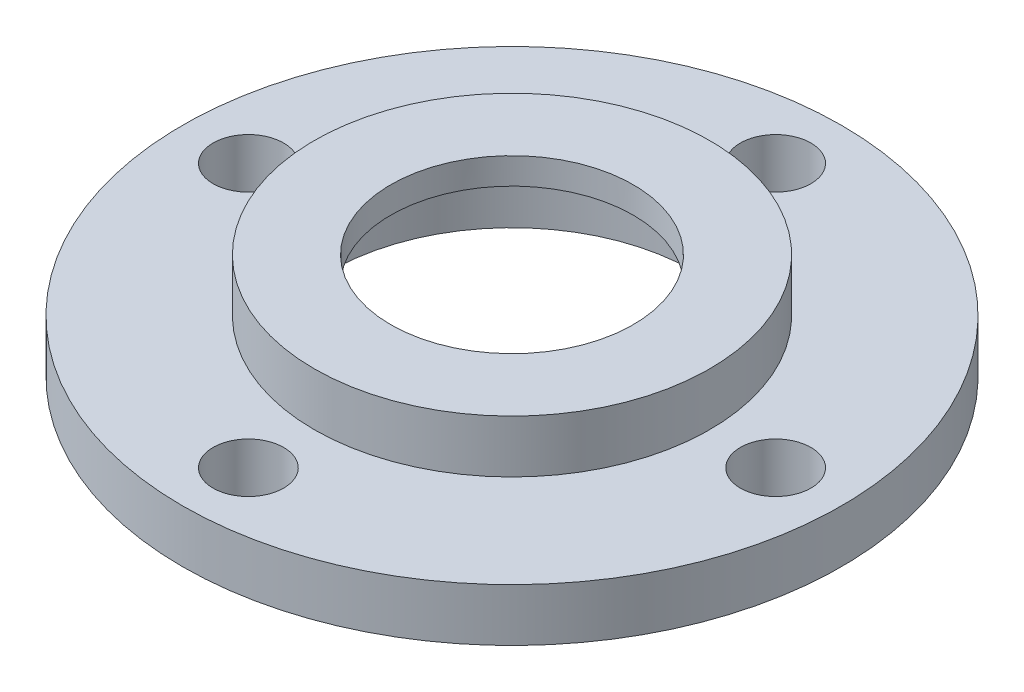
from build123d import *

# Parameters (mm, degrees)
SKETCH1_R           = 15.875
BOSS_EXTRUDE1_DEPTH = 2.54
SKETCH2_R           = 9.525
BOSS_EXTRUDE2_DEPTH = 2.54
SKETCH3_R           = 8.7757
CUT_EXTRUDE1_DEPTH  = 3.81
CUT_EXTRUDE2_REACH  = 25.018
SKETCH4_R           = 5.842
CUT_EXTRUDE3_REACH  = 24.594
SKETCH5_R           = 1.7


with BuildPart() as part:
    # Sketch1 → Boss-Extrude1 (new body)
    with BuildSketch(Plane(origin=(0, 0, 0), x_dir=(1, 0, 0), z_dir=(0, 1, 0))):
        with Locations(Location((0, 0, 0), (0, 0, 270))):
            Circle(SKETCH1_R)
    extrude(amount=BOSS_EXTRUDE1_DEPTH)

    # Sketch2 → Boss-Extrude2 (add)
    with BuildSketch(Plane(origin=(0, 2.54, 0), x_dir=(1, 0, 0), z_dir=(0, 1, 0))):
        with Locations(Location((0, 0, 0), (0, 0, 270))):
            Circle(SKETCH2_R)
    extrude(amount=BOSS_EXTRUDE2_DEPTH)

    # Sketch3 → Cut-Extrude1 (cut)
    with BuildSketch(Plane.XZ):
        with Locations(Location((0, 0, 0), (0, 0, 270))):
            Circle(SKETCH3_R)
    extrude(amount=-CUT_EXTRUDE1_DEPTH, mode=Mode.SUBTRACT)

    # Sketch4 → Cut-Extrude2 (cut, up to next)
    with BuildSketch(Plane(origin=(0, 5.08, 0), x_dir=(1, 0, 0), z_dir=(0, 1, 0)), mode=Mode.PRIVATE) as cut_extrude2_sk1:
        with Locations(Location((0, 0, 0), (0, 0, 270))):
            Circle(SKETCH4_R)
    cut_extrude2_tool1 = extrude(cut_extrude2_sk1.sketch, amount=-CUT_EXTRUDE2_REACH, mode=Mode.PRIVATE) & part.part
    add(cut_extrude2_tool1.solids().sort_by_distance((0, 5.08, 0))[0], mode=Mode.SUBTRACT)

    # Sketch5 → Cut-Extrude3 (cut, up to next)
    with BuildSketch(Plane(origin=(0, 2.54, 0), x_dir=(1, 0, 0), z_dir=(0, 1, 0)), mode=Mode.PRIVATE) as cut_extrude3_sk1:
        with Locations(Location((0, 12.7, 0), (0, 0, 270))):
            Circle(SKETCH5_R)
    cut_extrude3_tool1 = extrude(cut_extrude3_sk1.sketch, amount=-CUT_EXTRUDE3_REACH, mode=Mode.PRIVATE) & part.part
    # Sketch5 → Cut-Extrude3 (cut, up to next)
    with BuildSketch(Plane(origin=(0, 2.54, 0), x_dir=(1, 0, 0), z_dir=(0, 1, 0)), mode=Mode.PRIVATE) as cut_extrude3_sk2:
        with Locations(Location((12.7, 0, 0), (0, 0, 270))):
            Circle(SKETCH5_R)
    cut_extrude3_tool2 = extrude(cut_extrude3_sk2.sketch, amount=-CUT_EXTRUDE3_REACH, mode=Mode.PRIVATE) & part.part
    # Sketch5 → Cut-Extrude3 (cut, up to next)
    with BuildSketch(Plane(origin=(0, 2.54, 0), x_dir=(1, 0, 0), z_dir=(0, 1, 0)), mode=Mode.PRIVATE) as cut_extrude3_sk3:
        with Locations(Location((0, -12.7, 0), (0, 0, 270))):
            Circle(SKETCH5_R)
    cut_extrude3_tool3 = extrude(cut_extrude3_sk3.sketch, amount=-CUT_EXTRUDE3_REACH, mode=Mode.PRIVATE) & part.part
    # Sketch5 → Cut-Extrude3 (cut, up to next)
    with BuildSketch(Plane(origin=(0, 2.54, 0), x_dir=(1, 0, 0), z_dir=(0, 1, 0)), mode=Mode.PRIVATE) as cut_extrude3_sk4:
        with Locations(Location((-12.7, 0, 0), (0, 0, 270))):
            Circle(SKETCH5_R)
    cut_extrude3_tool4 = extrude(cut_extrude3_sk4.sketch, amount=-CUT_EXTRUDE3_REACH, mode=Mode.PRIVATE) & part.part
    add(cut_extrude3_tool1.solids().sort_by_distance((0, 2.54, -12.7))[0], mode=Mode.SUBTRACT)
    add(cut_extrude3_tool2.solids().sort_by_distance((12.7, 2.54, 0))[0], mode=Mode.SUBTRACT)
    add(cut_extrude3_tool3.solids().sort_by_distance((0, 2.54, 12.7))[0], mode=Mode.SUBTRACT)
    add(cut_extrude3_tool4.solids().sort_by_distance((-12.7, 2.54, 0))[0], mode=Mode.SUBTRACT)


solid = part.part
